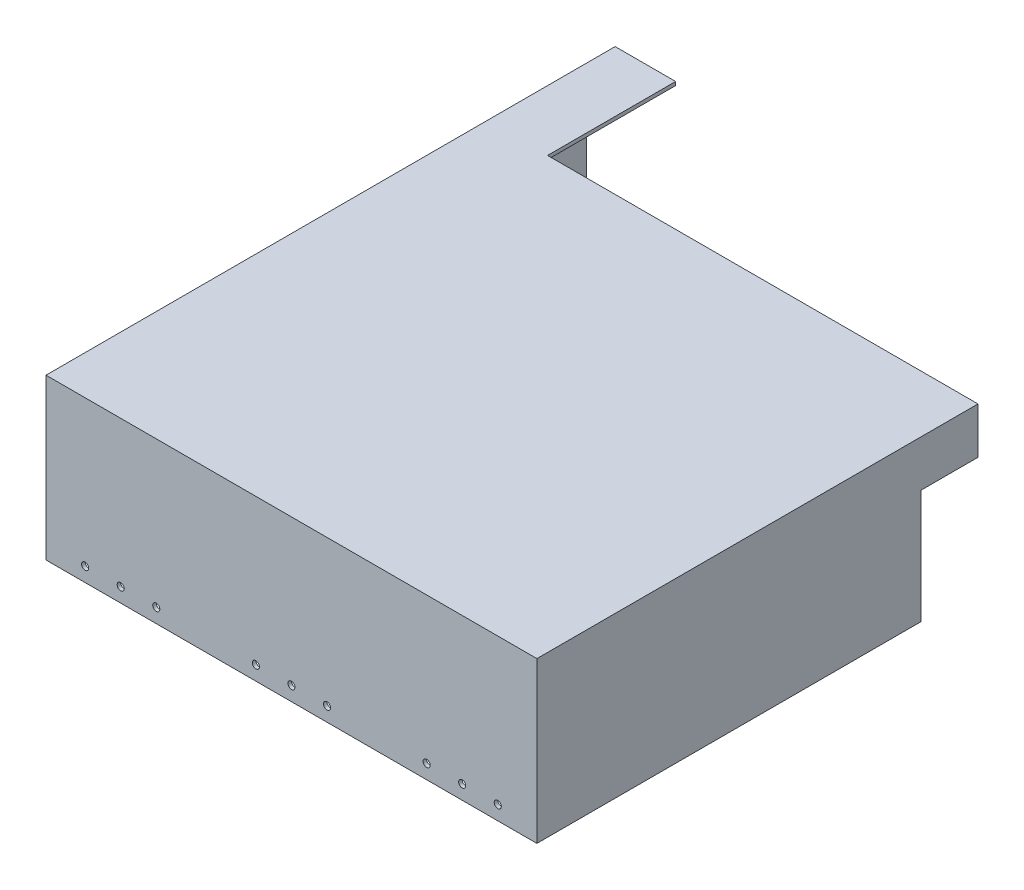
from build123d import *

# Parameters (mm, degrees)
BOSS_EXTRUDE1_DEPTH = 508
SKETCH2_W           = 438.15
SKETCH2_H           = 142.875
BOSS_EXTRUDE2_DEPTH = 3.175
SKETCH4_W           = 384.175
SKETCH4_H           = 114.3
CUT_EXTRUDE1_DEPTH  = 686.895537327
CUT_EXTRUDE2_REACH  = 687.896
SKETCH5_W           = 50.8
SKETCH5_H           = 101.6
CUT_EXTRUDE3_REACH  = 687.896
SKETCH6_W           = 28.575
SKETCH6_H           = 117.475
SKETCH7_R           = 3.175
CUT_EXTRUDE4_DEPTH  = 3.175


with BuildPart() as part:
    # Sketch1 → Boss-Extrude1 (new body)
    with BuildSketch(Plane.XY):
        Polygon((0, 0), (3.175, 0), (3.175, 139.7), (434.975, 139.7), (434.975, 0), (438.15, 0), (438.15, 142.875), (0, 142.875), align=None)
    extrude(amount=BOSS_EXTRUDE1_DEPTH)

    # Sketch2 → Boss-Extrude2 (add)
    with BuildSketch(Plane.XY.offset(508)):
        with Locations((219.075, 71.4375)):
            Rectangle(SKETCH2_W, SKETCH2_H)
    extrude(amount=-BOSS_EXTRUDE2_DEPTH)

    # Sketch4 → Cut-Extrude1 (cut, through all)
    with BuildSketch(Plane(origin=(0, 142.875, 0), x_dir=(1, 0, 0), z_dir=(0, 1, 0))):
        with Locations((246.0625, -57.15)):
            Rectangle(SKETCH4_W, SKETCH4_H)
    extrude(amount=-CUT_EXTRUDE1_DEPTH, mode=Mode.SUBTRACT)

    # Sketch5 → Cut-Extrude2 (cut, up to next)
    with BuildSketch(Plane(origin=(438.15, 0, 0), x_dir=(0, 0, -1), z_dir=(1, 0, 0)), mode=Mode.PRIVATE) as cut_extrude2_sk1:
        with Locations((-139.7, 50.8)):
            Rectangle(SKETCH5_W, SKETCH5_H)
    cut_extrude2_tool1 = extrude(cut_extrude2_sk1.sketch, amount=-CUT_EXTRUDE2_REACH, mode=Mode.PRIVATE) & part.part
    add(cut_extrude2_tool1.solids().sort_by_distance((438.15, 50.8, 139.7))[0], mode=Mode.SUBTRACT)

    # Sketch6 → Cut-Extrude3 (cut, up to next)
    with BuildSketch(Plane.ZY, mode=Mode.PRIVATE) as cut_extrude3_sk1:
        with Locations((14.2875, 58.7375)):
            Rectangle(SKETCH6_W, SKETCH6_H)
    cut_extrude3_tool1 = extrude(cut_extrude3_sk1.sketch, amount=-CUT_EXTRUDE3_REACH, mode=Mode.PRIVATE) & part.part
    add(cut_extrude3_tool1.solids().sort_by_distance((0, 58.7375, 14.2875))[0], mode=Mode.SUBTRACT)

    # Sketch7 → Cut-Extrude4 (cut)
    with BuildSketch(Plane.XY.offset(508)):
        with Locations((219.075, 12.7)):
            Circle(SKETCH7_R)
        with Locations((187.325, 12.7)):
            Circle(SKETCH7_R)
        with Locations((34.925, 12.7)):
            Circle(SKETCH7_R)
        with Locations((66.675, 12.7)):
            Circle(SKETCH7_R)
        with Locations((98.425, 12.7)):
            Circle(SKETCH7_R)
        with Locations((250.825, 12.7)):
            Circle(SKETCH7_R)
        with Locations((339.725, 12.7)):
            Circle(SKETCH7_R)
        with Locations((371.475, 12.7)):
            Circle(SKETCH7_R)
        with Locations((403.225, 12.7)):
            Circle(SKETCH7_R)
    extrude(amount=-CUT_EXTRUDE4_DEPTH, mode=Mode.SUBTRACT)


solid = part.part
